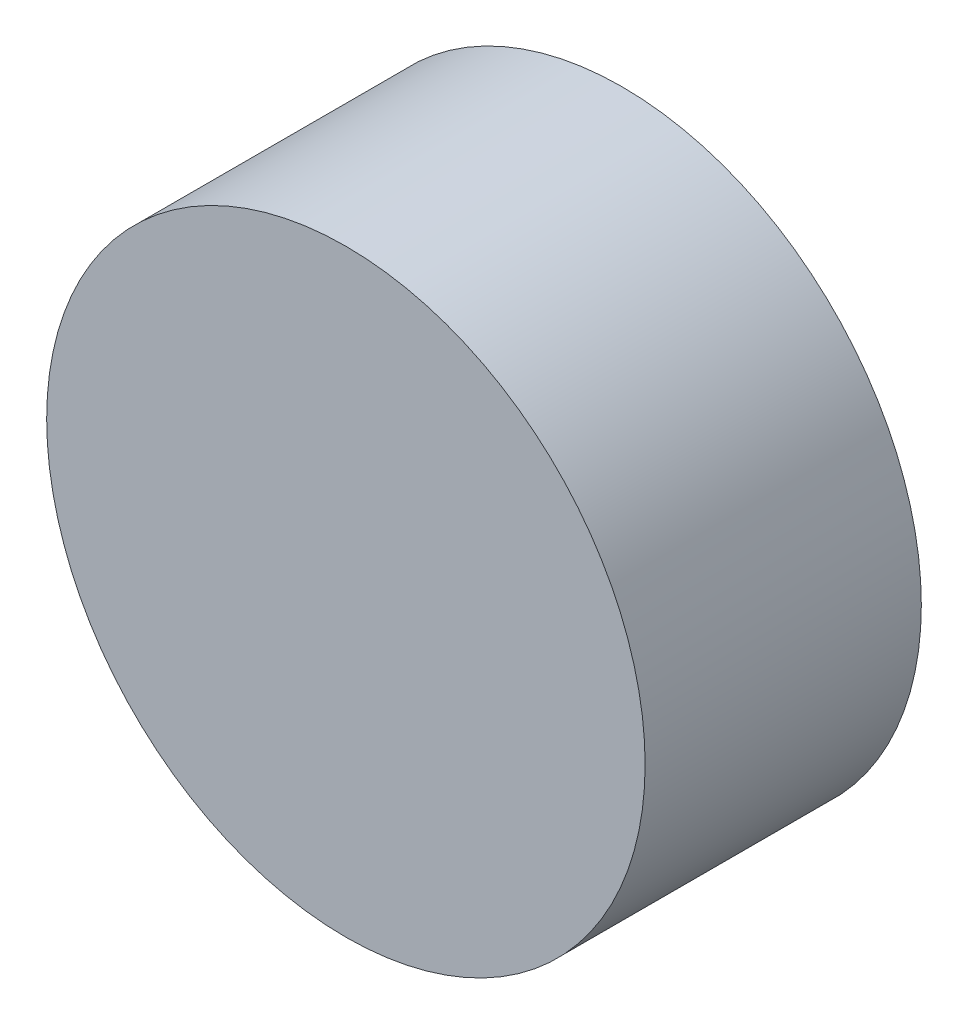
from build123d import *

# Parameters (mm, degrees)
SKETCH_1_R      = 13
YAW_MOTOR_DEPTH = 12


with BuildPart() as part:
    # 草图1 → Yaw_Motor (new body)
    with BuildSketch(Plane.XY):
        Circle(SKETCH_1_R)
    extrude(amount=YAW_MOTOR_DEPTH)


solid = part.part
